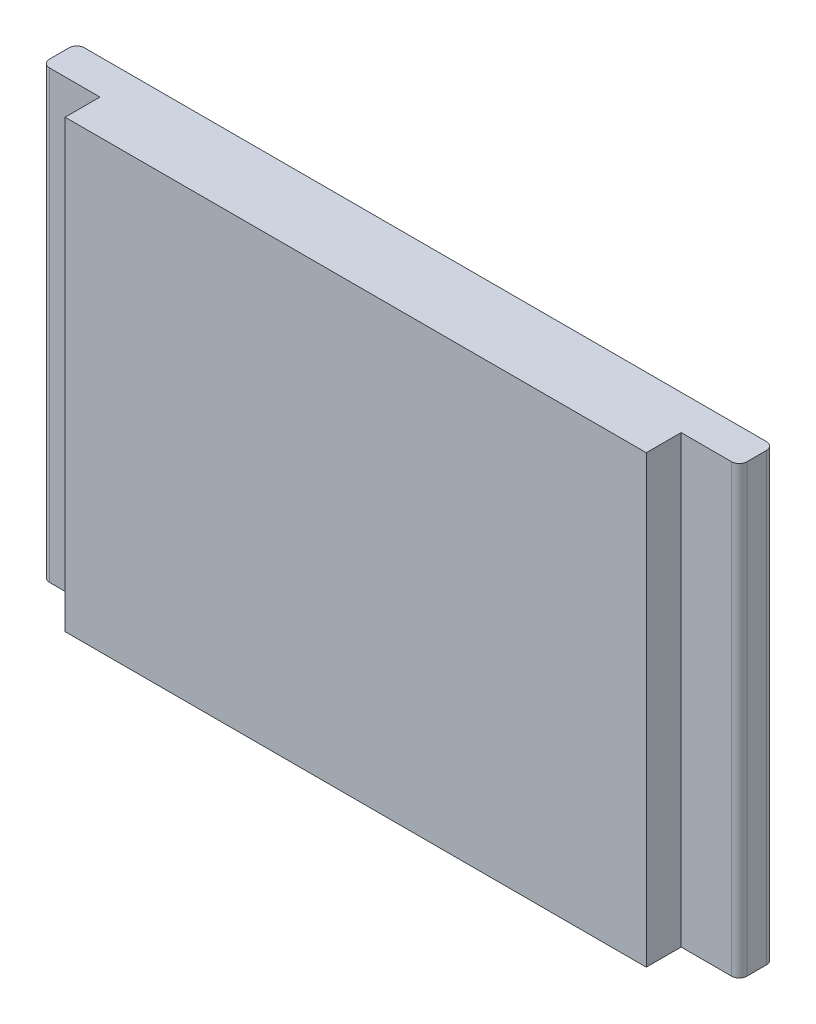
from build123d import *

# Parameters (mm, degrees)
BOSS_EXTRUDE2_DEPTH = 115
CUT_EXTRUDE1_DEPTH  = 2


with BuildPart() as part:
    # Sketch1 → Boss-Extrude2 (new body)
    with BuildSketch(Plane(origin=(0, 0, 0), x_dir=(1, 0, 0), z_dir=(0, 1, 0))):
        with BuildLine():
            Line((-98.788631121, 34.808160187), (-98.788631121, 29.808160187))
            ThreePointArc((-98.788631121, 29.808160187), (-98.202844683, 28.393946625), (-96.788631121, 27.808160187))
            Line((-96.788631121, 27.808160187), (-83.788631121, 27.808160187))
            Line((-83.788631121, 27.808160187), (-83.788631121, 18.808160187))
            Line((-83.788631121, 18.808160187), (66.211368879, 18.808160187))
            Line((66.211368879, 18.808160187), (66.211368879, 27.808160187))
            Line((66.211368879, 27.808160187), (79.211368879, 27.808160187))
            ThreePointArc((79.211368879, 27.808160187), (80.625582441, 28.393946625), (81.211368879, 29.808160187))
            Line((81.211368879, 29.808160187), (81.211368879, 34.808160187))
            ThreePointArc((81.211368879, 34.808160187), (80.625582441, 36.222373749), (79.211368879, 36.808160187))
            Line((79.211368879, 36.808160187), (-96.788631121, 36.808160187))
            ThreePointArc((-96.788631121, 36.808160187), (-98.202844683, 36.222373749), (-98.788631121, 34.808160187))
        make_face()
    extrude(amount=BOSS_EXTRUDE2_DEPTH)

    # Sketch2 → Cut-Extrude1 (cut)
    with BuildSketch(Plane(origin=(0, 0, -36.808160187), x_dir=(-1, 0, 0), z_dir=(0, 0, -1))):
        Polygon((27.408337163, 82.886030919), (3.413870614, 82.886030919), (20.114019332, 66.1858822), (9.364498318, 55.436361186), (33.071031269, 31.729828236), (-3.617725634, 55.436361186), (7.780473372, 66.1858822), (-18.469082879, 94.019463397), (27.408337163, 92.675773271), (31.055496079, 86.533189834), align=None)
    extrude(amount=-CUT_EXTRUDE1_DEPTH, mode=Mode.SUBTRACT)


solid = part.part
